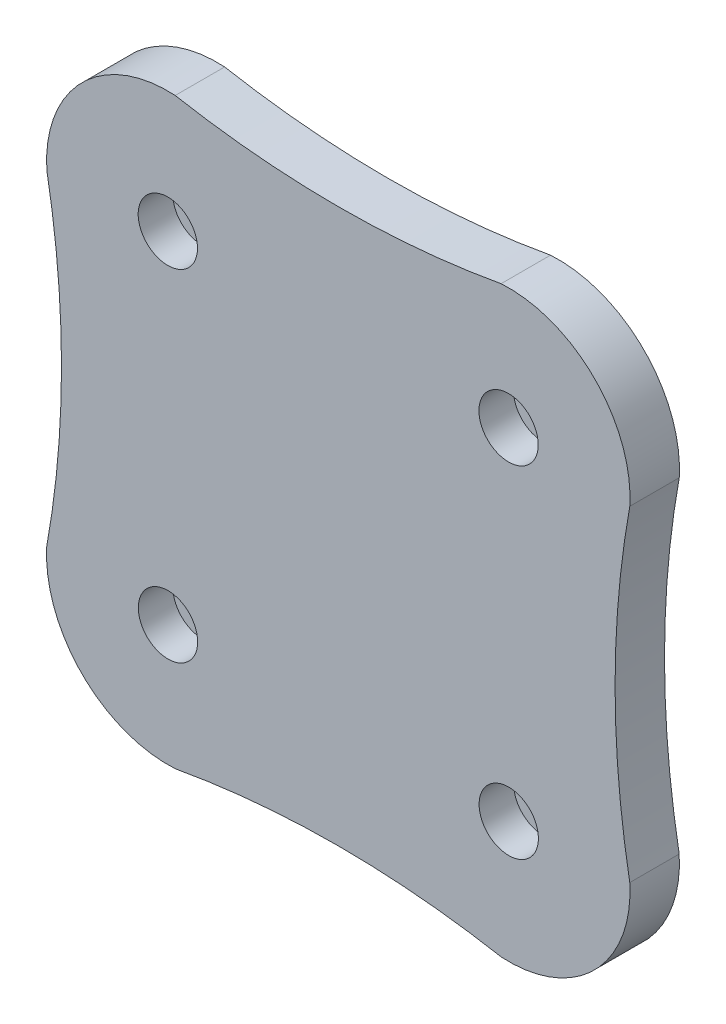
from build123d import *

# Parameters (mm, degrees)
SKETCH1_R           = 1.5
BOSS_EXTRUDE1_DEPTH = 5
SKETCH2_R           = 3
CUT_EXTRUDE2_DEPTH  = 3.5


with BuildPart() as part:
    # Sketch1 → Boss-Extrude1 (new body)
    with BuildSketch(Plane.XY):
        with BuildLine():
            ThreePointArc((23.501924453, -34.528637882), (39.985677368, -36.01999904), (56.469893836, -34.533770361))
            ThreePointArc((56.469893836, -34.533770361), (65.906534639, -38.094436046), (69.491362273, -47.521924608))
            ThreePointArc((69.491362273, -47.521924608), (68.000001115, -64.005677523), (69.486229793, -80.489893991))
            ThreePointArc((69.486229793, -80.489893991), (65.925564109, -89.926534793), (56.498075547, -93.511362427))
            ThreePointArc((56.498075547, -93.511362427), (40.014322632, -92.02000127), (23.530106164, -93.506229948))
            ThreePointArc((23.530106164, -93.506229948), (14.093465361, -89.945564264), (10.508637727, -80.518075701))
            ThreePointArc((10.508637727, -80.518075701), (11.999998885, -64.034322787), (10.513770207, -47.550106319))
            ThreePointArc((10.513770207, -47.550106319), (14.074435891, -38.113465516), (23.501924453, -34.528637882))
        make_face()
        with Locations((22.755781837, -46.793928993)):
            Circle(SKETCH1_R, mode=Mode.SUBTRACT)
        with Locations((57.226071162, -46.775781992)):
            Circle(SKETCH1_R, mode=Mode.SUBTRACT)
        with Locations((57.244218163, -81.246071317)):
            Circle(SKETCH1_R, mode=Mode.SUBTRACT)
        with Locations((22.773928838, -81.264218317)):
            Circle(SKETCH1_R, mode=Mode.SUBTRACT)
    extrude(amount=BOSS_EXTRUDE1_DEPTH)

    # Sketch2 → Cut-Extrude2 (cut)
    with BuildSketch(Plane.XY.offset(5)):
        with Locations((22.755781837, -46.793928993)):
            Circle(SKETCH2_R)
        with Locations((57.226071162, -46.775781992)):
            Circle(SKETCH2_R)
        with Locations((57.244218163, -81.246071317)):
            Circle(SKETCH2_R)
        with Locations((22.773928838, -81.264218317)):
            Circle(SKETCH2_R)
    extrude(amount=-CUT_EXTRUDE2_DEPTH, mode=Mode.SUBTRACT)


solid = part.part
